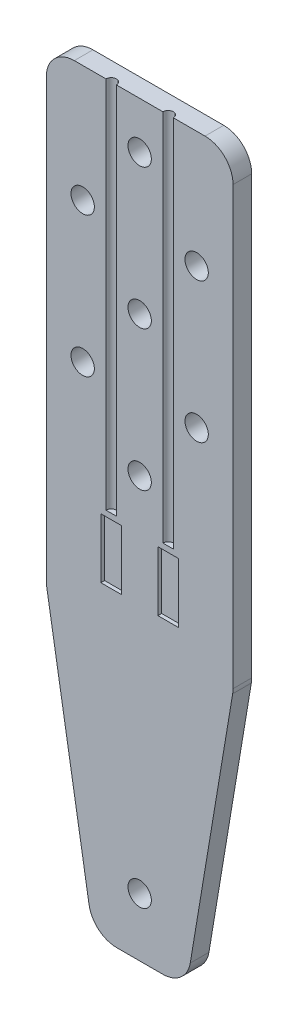
from build123d import *

# Parameters (mm, degrees)
EXTRUDE1_DEPTH     = 2.54
SKETCH2_R          = 1.5875
CUT_EXTRUDE1_DEPTH = 2.54
SKETCH3_W          = 2.794
SKETCH3_H          = 8.128
CUT_EXTRUDE2_DEPTH = 0.508
SKETCH4_R          = 0.7112
CUT_EXTRUDE3_DEPTH = 50.8
FILLET1_R          = 3.81
SKETCH5_R          = 1.5875
CUT_EXTRUDE4_DEPTH = 2.54


with BuildPart() as part:
    # Sketch1 → Extrude1 (new body)
    with BuildSketch(Plane.XY):
        Polygon((88.9, 127), (88.9, 63.5), (95.25, 25.4), (107.95, 25.4), (114.3, 63.5), (114.3, 127), align=None)
    extrude(amount=-EXTRUDE1_DEPTH)

    # Sketch2 → Cut-Extrude1 (cut)
    with BuildSketch(Plane.XY):
        with Locations((93.850000001, 111.125)):
            Circle(SKETCH2_R)
        with Locations((101.6, 120.65)):
            Circle(SKETCH2_R)
        with Locations((109.349999999, 111.125)):
            Circle(SKETCH2_R)
        with Locations((101.6, 101.6)):
            Circle(SKETCH2_R)
        with Locations((93.850000001, 92.075)):
            Circle(SKETCH2_R)
        with Locations((109.349999999, 92.075)):
            Circle(SKETCH2_R)
        with Locations((101.6, 82.55)):
            Circle(SKETCH2_R)
    extrude(amount=-CUT_EXTRUDE1_DEPTH, mode=Mode.SUBTRACT)

    # Sketch3 → Cut-Extrude2 (cut)
    with BuildSketch(Plane.XY):
        with Locations((97.725, 71.374)):
            Rectangle(SKETCH3_W, SKETCH3_H)
        with Locations((105.475, 71.374)):
            Rectangle(SKETCH3_W, SKETCH3_H)
    extrude(amount=-CUT_EXTRUDE2_DEPTH, mode=Mode.SUBTRACT)

    # Sketch4 → Cut-Extrude3 (cut)
    with BuildSketch(Plane(origin=(0, 127, 0), x_dir=(1, 0, 0), z_dir=(0, 1, 0))):
        with Locations((97.725, 0)):
            Circle(SKETCH4_R)
        with Locations((105.475, 0)):
            Circle(SKETCH4_R)
    extrude(amount=-CUT_EXTRUDE3_DEPTH, mode=Mode.SUBTRACT)

    # Fillet1
    fillet1_edges = [part.edges().sort_by_distance(p)[0] for p in [
        (95.25, 25.4, -1.27),
        (88.9, 63.5, -1.27),
        (88.9, 127, -1.27),
        (114.3, 127, -1.27),
        (114.3, 63.5, -1.27),
        (107.95, 25.4, -1.27),
    ]]
    fillet(fillet1_edges, radius=FILLET1_R)

    # Sketch5 → Cut-Extrude4 (cut)
    with BuildSketch(Plane.XY):
        with Locations((101.6, 33.3375)):
            Circle(SKETCH5_R)
    extrude(amount=-CUT_EXTRUDE4_DEPTH, mode=Mode.SUBTRACT)


solid = part.part
